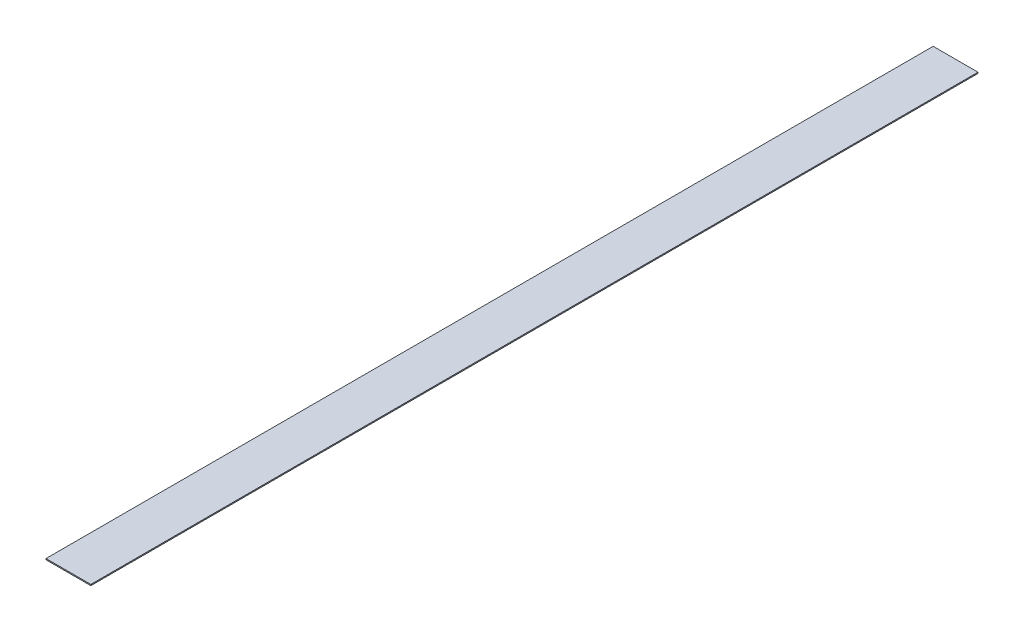
from build123d import *

# Parameters (mm, degrees)
SKETCH1_W           = 50.8
SKETCH1_H           = 1005.332
BOSS_EXTRUDE1_DEPTH = 1.27


with BuildPart() as part:
    # Sketch1 → Boss-Extrude1 (new body)
    with BuildSketch(Plane(origin=(0, 0, 0), x_dir=(1, 0, 0), z_dir=(0, 1, 0))):
        Rectangle(SKETCH1_W, SKETCH1_H)
    extrude(amount=BOSS_EXTRUDE1_DEPTH)


solid = part.part
